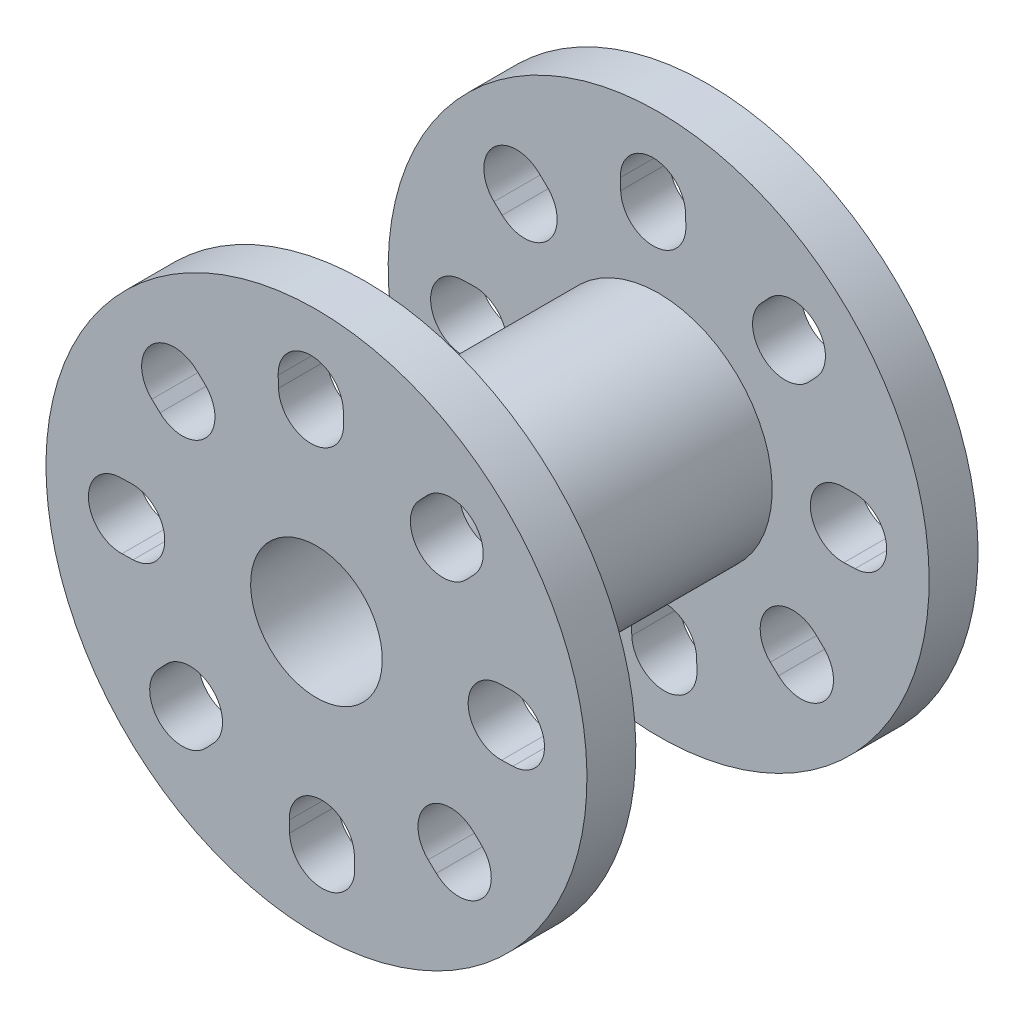
from build123d import *

# Parameters (mm, degrees)
SKETCH_4_R      = 16.6
SKETCH_4_R_2    = 4.04
EXTRUDE_1_DEPTH = 3
SKETCH_5_R      = 6.965633075
SKETCH_5_R_2    = 4.04
EXTRUDE_2_DEPTH = 18
SKETCH_8_R      = 16.6
SKETCH_8_R_2    = 4.04
EXTRUDE_3_DEPTH = 3


with BuildPart() as part:
    # 草图4 → 凸台-拉伸1 (new body)
    with BuildSketch(Plane(origin=(0, 0, -1.4), x_dir=(-1, 0, 0), z_dir=(0, 0, -1))):
        with Locations(Location((0, 0, 0), (0, 0, 90))):
            Circle(SKETCH_4_R)
        with Locations(Location((0, 0, 0), (0, 0, 90))):
            Circle(SKETCH_4_R_2, mode=Mode.SUBTRACT)
        with BuildLine():
            Line((-6.779374808, 10.101488861), (-6.308451432, 9.602262261))
            ThreePointArc((-6.308451432, 9.602262261), (-6.390933071, 6.775038043), (-9.218157289, 6.857519682))
            Line((-9.218157289, 6.857519682), (-9.689080665, 7.356746282))
            ThreePointArc((-9.689080665, 7.356746282), (-10.233377153, 8.787440898), (-9.606599026, 10.1839705))
            ThreePointArc((-9.606599026, 10.1839705), (-8.17590441, 10.728266988), (-6.779374808, 10.101488861))
        make_face(mode=Mode.SUBTRACT)
        with BuildLine():
            Line((-1.66922286, 11.367220199), (-1.649209458, 12.053219826))
            ThreePointArc((-1.649209458, 12.053219826), (-1.022431331, 13.449749428), (0.408263285, 13.994045916))
            ThreePointArc((0.408263285, 13.994045916), (1.804792887, 13.367267789), (2.349089375, 11.936573173))
            Line((2.349089375, 11.936573173), (2.329075973, 11.250573546))
            ThreePointArc((2.329075973, 11.250573546), (0.27160323, 9.309747456), (-1.66922286, 11.367220199))
        make_face(mode=Mode.SUBTRACT)
        with BuildLine():
            Line((6.857519682, 9.218157289), (7.356746282, 9.689080665))
            ThreePointArc((7.356746282, 9.689080665), (8.787440898, 10.233377153), (10.1839705, 9.606599026))
            ThreePointArc((10.1839705, 9.606599026), (10.728266988, 8.17590441), (10.101488861, 6.779374808))
            Line((10.101488861, 6.779374808), (9.602262261, 6.308451432))
            ThreePointArc((9.602262261, 6.308451432), (6.775038043, 6.390933071), (6.857519682, 9.218157289))
        make_face(mode=Mode.SUBTRACT)
        with BuildLine():
            Line((11.367220199, 1.66922286), (12.053219826, 1.649209458))
            ThreePointArc((12.053219826, 1.649209458), (13.449749428, 1.022431331), (13.994045916, -0.408263285))
            ThreePointArc((13.994045916, -0.408263285), (13.367267789, -1.804792887), (11.936573173, -2.349089375))
            Line((11.936573173, -2.349089375), (11.250573546, -2.329075973))
            ThreePointArc((11.250573546, -2.329075973), (9.309747456, -0.27160323), (11.367220199, 1.66922286))
        make_face(mode=Mode.SUBTRACT)
        with BuildLine():
            Line((9.218157289, -6.857519682), (9.689080665, -7.356746282))
            ThreePointArc((9.689080665, -7.356746282), (10.233377153, -8.787440898), (9.606599026, -10.1839705))
            ThreePointArc((9.606599026, -10.1839705), (8.17590441, -10.728266988), (6.779374808, -10.101488861))
            Line((6.779374808, -10.101488861), (6.308451432, -9.602262261))
            ThreePointArc((6.308451432, -9.602262261), (6.390933071, -6.775038043), (9.218157289, -6.857519682))
        make_face(mode=Mode.SUBTRACT)
        with BuildLine():
            Line((1.66922286, -11.367220199), (1.649209458, -12.053219826))
            ThreePointArc((1.649209458, -12.053219826), (1.022431331, -13.449749428), (-0.408263285, -13.994045916))
            ThreePointArc((-0.408263285, -13.994045916), (-1.804792887, -13.367267789), (-2.349089375, -11.936573173))
            Line((-2.349089375, -11.936573173), (-2.329075973, -11.250573546))
            ThreePointArc((-2.329075973, -11.250573546), (-0.27160323, -9.309747456), (1.66922286, -11.367220199))
        make_face(mode=Mode.SUBTRACT)
        with BuildLine():
            Line((-6.857519682, -9.218157289), (-7.356746282, -9.689080665))
            ThreePointArc((-7.356746282, -9.689080665), (-8.787440898, -10.233377153), (-10.1839705, -9.606599026))
            ThreePointArc((-10.1839705, -9.606599026), (-10.728266988, -8.17590441), (-10.101488861, -6.779374808))
            Line((-10.101488861, -6.779374808), (-9.602262261, -6.308451432))
            ThreePointArc((-9.602262261, -6.308451432), (-6.775038043, -6.390933071), (-6.857519682, -9.218157289))
        make_face(mode=Mode.SUBTRACT)
        with BuildLine():
            Line((-11.367220199, -1.66922286), (-12.053219826, -1.649209458))
            ThreePointArc((-12.053219826, -1.649209458), (-13.449749428, -1.022431331), (-13.994045916, 0.408263285))
            ThreePointArc((-13.994045916, 0.408263285), (-13.367267789, 1.804792887), (-11.936573173, 2.349089375))
            Line((-11.936573173, 2.349089375), (-11.250573546, 2.329075973))
            ThreePointArc((-11.250573546, 2.329075973), (-9.309747456, 0.27160323), (-11.367220199, -1.66922286))
        make_face(mode=Mode.SUBTRACT)
    extrude(amount=EXTRUDE_1_DEPTH)

    # 草图5 → 凸台-拉伸2 (add)
    with BuildSketch(Plane(origin=(0, 0, -4.4), x_dir=(-1, 0, 0), z_dir=(0, 0, -1))):
        with Locations(Location((0, 0, 0), (0, 0, 90))):
            Circle(SKETCH_5_R)
        with Locations(Location((0, 0, 0), (0, 0, 90))):
            Circle(SKETCH_5_R_2, mode=Mode.SUBTRACT)
    extrude(amount=EXTRUDE_2_DEPTH)


with BuildPart() as body_2:
    # 草图8 → 凸台-拉伸3 (new body)
    with BuildSketch(Plane(origin=(0, 0, -22.4), x_dir=(-1, 0, 0), z_dir=(0, 0, -1))):
        with Locations(Location((0, 0, 0), (0, 0, 90))):
            Circle(SKETCH_8_R)
        with Locations(Location((0, 0, 0), (0, 0, 90))):
            Circle(SKETCH_8_R_2, mode=Mode.SUBTRACT)
        with BuildLine():
            Line((-2.329075973, -11.250573546), (-2.349089375, -11.936573173))
            ThreePointArc((-2.349089375, -11.936573173), (-0.408263285, -13.994045916), (1.649209458, -12.053219826))
            Line((1.649209458, -12.053219826), (1.66922286, -11.367220199))
            ThreePointArc((1.66922286, -11.367220199), (-0.27160323, -9.309747456), (-2.329075973, -11.250573546))
        make_face(mode=Mode.SUBTRACT)
        with BuildLine():
            Line((-9.602262261, -6.308451432), (-10.101488861, -6.779374808))
            ThreePointArc((-10.101488861, -6.779374808), (-10.1839705, -9.606599026), (-7.356746282, -9.689080665))
            Line((-7.356746282, -9.689080665), (-6.857519682, -9.218157289))
            ThreePointArc((-6.857519682, -9.218157289), (-6.775038043, -6.390933071), (-9.602262261, -6.308451432))
        make_face(mode=Mode.SUBTRACT)
        with BuildLine():
            Line((-11.250573546, 2.329075973), (-11.936573173, 2.349089375))
            ThreePointArc((-11.936573173, 2.349089375), (-13.994045916, 0.408263285), (-12.053219826, -1.649209458))
            Line((-12.053219826, -1.649209458), (-11.367220199, -1.66922286))
            ThreePointArc((-11.367220199, -1.66922286), (-9.309747456, 0.27160323), (-11.250573546, 2.329075973))
        make_face(mode=Mode.SUBTRACT)
        with BuildLine():
            Line((-6.308451432, 9.602262261), (-6.779374808, 10.101488861))
            ThreePointArc((-6.779374808, 10.101488861), (-9.606599026, 10.1839705), (-9.689080665, 7.356746282))
            Line((-9.689080665, 7.356746282), (-9.218157289, 6.857519682))
            ThreePointArc((-9.218157289, 6.857519682), (-6.390933071, 6.775038043), (-6.308451432, 9.602262261))
        make_face(mode=Mode.SUBTRACT)
        with BuildLine():
            Line((2.329075973, 11.250573546), (2.349089375, 11.936573173))
            ThreePointArc((2.349089375, 11.936573173), (0.408263285, 13.994045916), (-1.649209458, 12.053219826))
            Line((-1.649209458, 12.053219826), (-1.66922286, 11.367220199))
            ThreePointArc((-1.66922286, 11.367220199), (0.27160323, 9.309747456), (2.329075973, 11.250573546))
        make_face(mode=Mode.SUBTRACT)
        with BuildLine():
            Line((9.602262261, 6.308451432), (10.101488861, 6.779374808))
            ThreePointArc((10.101488861, 6.779374808), (10.1839705, 9.606599026), (7.356746282, 9.689080665))
            Line((7.356746282, 9.689080665), (6.857519682, 9.218157289))
            ThreePointArc((6.857519682, 9.218157289), (6.775038043, 6.390933071), (9.602262261, 6.308451432))
        make_face(mode=Mode.SUBTRACT)
        with BuildLine():
            Line((11.250573546, -2.329075973), (11.936573173, -2.349089375))
            ThreePointArc((11.936573173, -2.349089375), (13.994045916, -0.408263285), (12.053219826, 1.649209458))
            Line((12.053219826, 1.649209458), (11.367220199, 1.66922286))
            ThreePointArc((11.367220199, 1.66922286), (9.309747456, -0.27160323), (11.250573546, -2.329075973))
        make_face(mode=Mode.SUBTRACT)
        with BuildLine():
            Line((6.308451432, -9.602262261), (6.779374808, -10.101488861))
            ThreePointArc((6.779374808, -10.101488861), (9.606599026, -10.1839705), (9.689080665, -7.356746282))
            Line((9.689080665, -7.356746282), (9.218157289, -6.857519682))
            ThreePointArc((9.218157289, -6.857519682), (6.390933071, -6.775038043), (6.308451432, -9.602262261))
        make_face(mode=Mode.SUBTRACT)
    extrude(amount=EXTRUDE_3_DEPTH)


solid = Compound([part.part, body_2.part])
